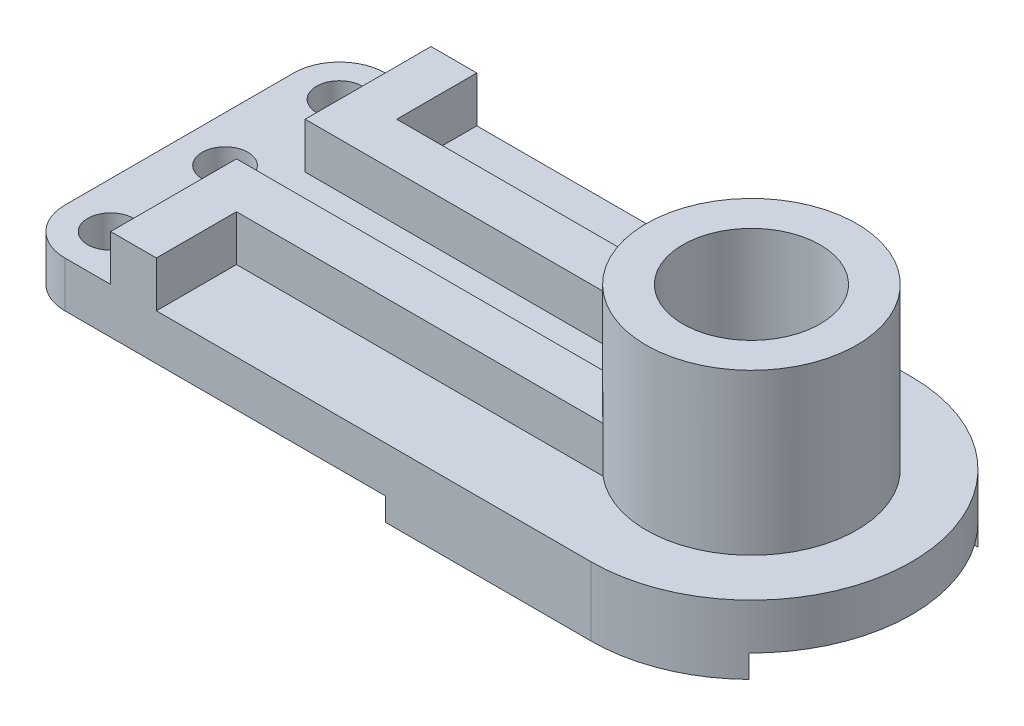
from build123d import *

# Parameters (mm, degrees)
EXTRUDE_1_DEPTH     = 10
SKETCH_1_R          = 5
EXTRUDE_1_2_DEPTH   = 10
EXTRUDE_2_DEPTH     = 20
SKETCH_1_4_R        = 23
SKETCH_1_4_R_2      = 15
EXTRUDE_3_DEPTH     = 45
SKETCH_1_5_R        = 17.5
SKETCH_1_5_R_2      = 15
CUT_EXTRUDE_1_DEPTH = 5
EXTRUDE_START       = 5
EXTRUDE_4_DEPTH     = 5


with BuildPart() as part:
    # 草图1 → 凸台-拉伸1 (new body)
    with BuildSketch(Plane(origin=(0, 0, 0), x_dir=(1, 0, 0), z_dir=(0, 1, 0))):
        with BuildLine():
            ThreePointArc((0, -35), (35, 0), (0, 35))
            Line((0, 35), (-95, 35))
            Line((-95, 35), (-95, 17.5))
            Line((-95, 17.5), (-14.924811557, 17.5))
            ThreePointArc((-14.924811557, 17.5), (23, 0), (-14.924811557, -17.5))
            Line((-14.924811557, -17.5), (-95, -17.5))
            Line((-95, -17.5), (-95, -35))
            Line((-95, -35), (0, -35))
        make_face()
    extrude(amount=EXTRUDE_1_DEPTH)



with BuildPart() as body_2:
    # 草图1 → Extrude 1 2 (new body)
    with BuildSketch(Plane(origin=(0, 0, 0), x_dir=(1, 0, 0), z_dir=(0, 1, 0))):
        with BuildLine():
            Line((-105, 7.5), (-105, 35))
            Line((-105, 35), (-115, 35))
            ThreePointArc((-115, 35), (-122.071067812, 32.071067812), (-125, 25))
            Line((-125, 25), (-125, -25))
            ThreePointArc((-125, -25), (-122.071067812, -32.071067812), (-115, -35))
            Line((-115, -35), (-105, -35))
            Line((-105, -35), (-105, -7.5))
            Line((-105, -7.5), (-21.742814905, -7.5))
            ThreePointArc((-21.742814905, -7.5), (-23, 0), (-21.742814905, 7.5))
            Line((-21.742814905, 7.5), (-105, 7.5))
        make_face()
        with BuildLine():
            Line((-70, 2.5), (-70, -2.5))
            Line((-70, -2.5), (-110.669872981, -2.5))
            ThreePointArc((-110.669872981, -2.5), (-120, 0), (-110.669872981, 2.5))
            Line((-110.669872981, 2.5), (-70, 2.5))
        make_face(mode=Mode.SUBTRACT)
        with Locations((-115, 25)):
            Circle(SKETCH_1_R, mode=Mode.SUBTRACT)
        with Locations((-115, -25)):
            Circle(SKETCH_1_R, mode=Mode.SUBTRACT)
    extrude(amount=EXTRUDE_1_2_DEPTH)


with BuildPart() as part_1:
    add(part.part)

    add(body_2.part)  # 凸台-拉伸2 merges body 2
    # 草图1<3> → 凸台-拉伸2 (add)
    with BuildSketch(Plane(origin=(0, 0, 0), x_dir=(1, 0, 0), z_dir=(0, 1, 0))):
        with BuildLine():
            Line((-95, 17.5), (-95, 35))
            Line((-95, 35), (-105, 35))
            Line((-105, 35), (-105, 7.5))
            Line((-105, 7.5), (-21.742814905, 7.5))
            ThreePointArc((-21.742814905, 7.5), (-19.00338674, 12.956515443), (-14.924811557, 17.5))
            Line((-14.924811557, 17.5), (-95, 17.5))
        make_face()
        with BuildLine():
            Line((-105, -35), (-95, -35))
            Line((-95, -35), (-95, -17.5))
            Line((-95, -17.5), (-14.924811557, -17.5))
            ThreePointArc((-14.924811557, -17.5), (-19.00338674, -12.956515443), (-21.742814905, -7.5))
            Line((-21.742814905, -7.5), (-105, -7.5))
            Line((-105, -7.5), (-105, -35))
        make_face()
    extrude(amount=EXTRUDE_2_DEPTH)

    # 草图1<4> → 凸台-拉伸3 (add)
    with BuildSketch(Plane(origin=(0, 0, 0), x_dir=(1, 0, 0), z_dir=(0, 1, 0))):
        Circle(SKETCH_1_4_R)
        Circle(SKETCH_1_4_R_2, mode=Mode.SUBTRACT)
    extrude(amount=EXTRUDE_3_DEPTH)

    # 草图1<5> → 切除-拉伸1 (cut)
    with BuildSketch(Plane(origin=(0, 0, 0), x_dir=(1, 0, 0), z_dir=(0, 1, 0))):
        Circle(SKETCH_1_5_R)
        Circle(SKETCH_1_5_R_2, mode=Mode.SUBTRACT)
    extrude(amount=CUT_EXTRUDE_1_DEPTH, mode=Mode.SUBTRACT)

    # 草图2 → 凸台-拉伸4 (add)
    with BuildSketch(Plane.XZ.offset(EXTRUDE_START)):
        with BuildLine():
            Line((-45, 35), (0, 35))
            ThreePointArc((0, 35), (13.228756555, 32.403703492), (24.494897428, 25))
            Line((24.494897428, 25), (-45, 25))
            Line((-45, 25), (-45, 35))
        make_face()
        with BuildLine():
            Line((-45, -25), (24.494897428, -25))
            ThreePointArc((24.494897428, -25), (13.228756555, -32.403703492), (0, -35))
            Line((0, -35), (-45, -35))
            Line((-45, -35), (-45, -25))
        make_face()
    extrude(amount=-EXTRUDE_4_DEPTH)


solid = part_1.part
